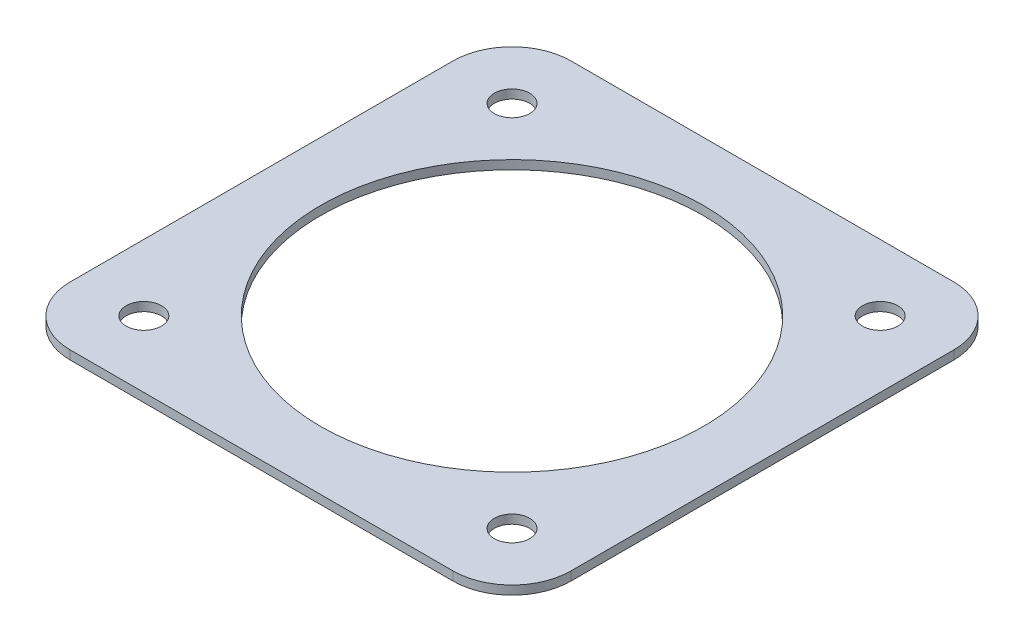
from build123d import *

# Parameters (mm, degrees)
SKETCH_1_R      = 6
SKETCH_1_R_2    = 65
EXTRUDE_1_DEPTH = 3


with BuildPart() as part:
    # Эскиз1 → Бобышка-Вытянуть1 (new body)
    with BuildSketch(Plane(origin=(0, 0, 0), x_dir=(1, 0, 0), z_dir=(0, 1, 0))):
        with BuildLine():
            Line((65, -85), (-65, -85))
            ThreePointArc((-65, -85), (-79.142135624, -79.142135624), (-85, -65))
            Line((-85, -65), (-85, 65))
            ThreePointArc((-85, 65), (-79.142135624, 79.142135624), (-65, 85))
            Line((-65, 85), (65, 85))
            ThreePointArc((65, 85), (79.142135624, 79.142135624), (85, 65))
            Line((85, 65), (85, -65))
            ThreePointArc((85, -65), (79.142135624, -79.142135624), (65, -85))
        make_face()
        with Locations(Location((-62.5, -62.5, 0), (0, 0, 270))):
            Circle(SKETCH_1_R, mode=Mode.SUBTRACT)
        with Locations(Location((-62.5, 62.5, 0), (0, 0, 270))):
            Circle(SKETCH_1_R, mode=Mode.SUBTRACT)
        with Locations(Location((62.5, 62.5, 0), (0, 0, 270))):
            Circle(SKETCH_1_R, mode=Mode.SUBTRACT)
        with Locations(Location((62.5, -62.5, 0), (0, 0, 270))):
            Circle(SKETCH_1_R, mode=Mode.SUBTRACT)
        with Locations(Location((0, 0, 0), (0, 0, 270))):
            Circle(SKETCH_1_R_2, mode=Mode.SUBTRACT)
    extrude(amount=EXTRUDE_1_DEPTH)


solid = part.part
